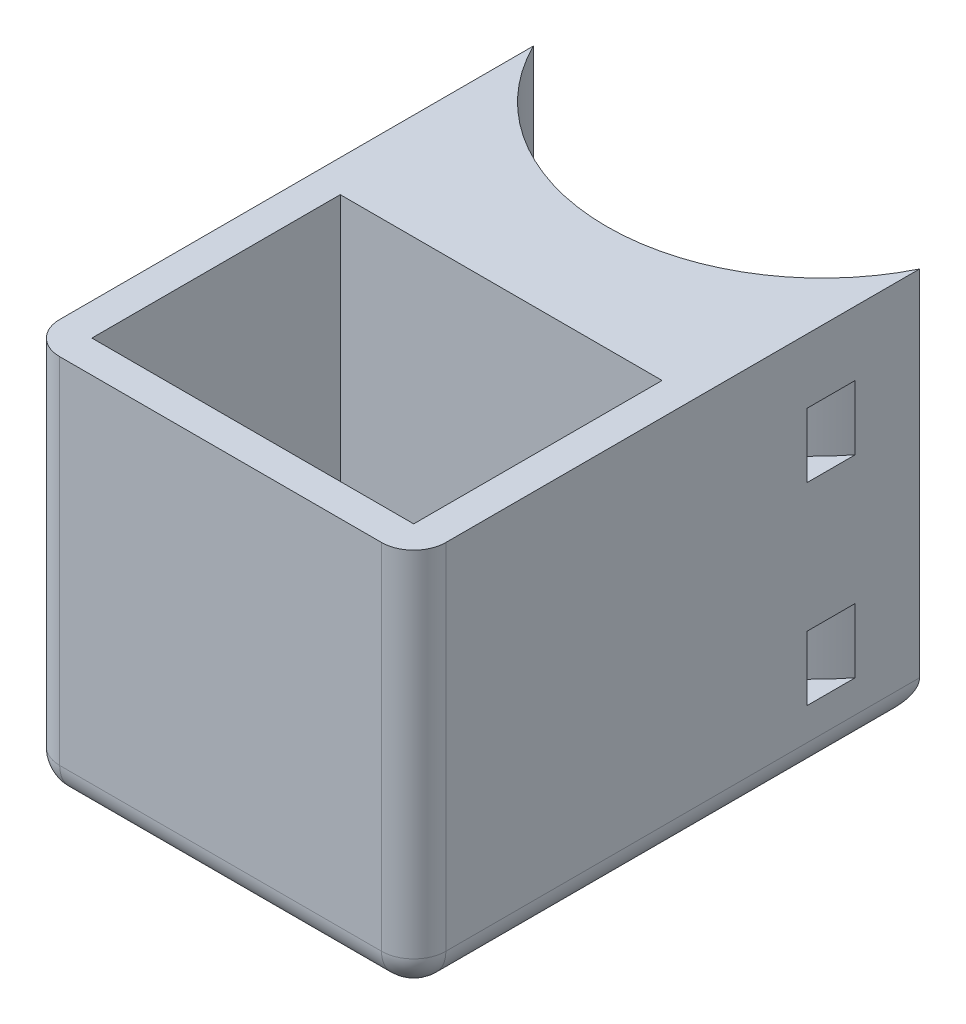
from build123d import *
from OCP.BRepFilletAPI import BRepFilletAPI_MakeChamfer

# Parameters (mm, degrees)
SKETCH2_W           = 152.4
SKETCH2_H           = 152.4
BOSS_EXTRUDE1_DEPTH = 25.4
BOSS_EXTRUDE2_DEPTH = 101.6
BOSS_EXTRUDE5_START = 50.8
BOSS_EXTRUDE5_DEPTH = 50.8
BOSS_EXTRUDE6_DEPTH = 25.4
SKETCH6_W           = 127
SKETCH6_H           = 98.02354915
CUT_EXTRUDE1_DEPTH  = 139.7
SKETCH7_R           = 8.255
CUT_EXTRUDE2_DEPTH  = 12.7
CHAMFER1_SIZE       = 7.62
CHAMFER1_SIZE2      = 2.773453185
FILLET1_R           = 12.7


with BuildPart() as part:
    # Sketch2 → Boss-Extrude1 (new body)
    with BuildSketch(Plane(origin=(0, 0, 0), x_dir=(1, 0, 0), z_dir=(0, 1, 0))):
        with BuildLine():
            Line((0, 76.2), (76.2, 76.2))
            Line((76.2, 76.2), (76.2, 123.42354915))
            ThreePointArc((76.2, 123.42354915), (44.823274072, 88.963087986), (0, 76.2))
        make_face()
        with BuildLine():
            Line((-76.2, 123.42354915), (-76.2, 76.2))
            Line((-76.2, 76.2), (0, 76.2))
            ThreePointArc((0, 76.2), (-44.823274072, 88.963087986), (-76.2, 123.42354915))
        make_face()
        Rectangle(SKETCH2_W, SKETCH2_H)
    extrude(amount=BOSS_EXTRUDE1_DEPTH)

    # Sketch3 → Boss-Extrude2 (add)
    with BuildSketch(Plane(origin=(0, 25.4, 0), x_dir=(1, 0, 0), z_dir=(0, 1, 0))):
        with BuildLine():
            ThreePointArc((76.2, 123.42354915), (0, 76.2), (-76.2, 123.42354915))
            Line((-76.2, 123.42354915), (-76.2, 98.02354915))
            ThreePointArc((-76.2, 98.02354915), (0, 60.787742764), (76.2, 98.02354915))
            Line((76.2, 98.02354915), (76.2, 123.42354915))
        make_face()
        with BuildLine():
            ThreePointArc((76.2, 78.97354915), (0, 46.95399651), (-76.2, 78.97354915))
            Line((-76.2, 78.97354915), (-76.2, -76.2))
            Line((-76.2, -76.2), (76.2, -76.2))
            Line((76.2, -76.2), (76.2, 78.97354915))
        make_face()
    extrude(amount=BOSS_EXTRUDE2_DEPTH)

    # Sketch5 → Boss-Extrude5 (add)
    with BuildSketch(Plane(origin=(0, 0, 0), x_dir=(1, 0, 0), z_dir=(0, 1, 0)).offset(BOSS_EXTRUDE5_START)):
        with BuildLine():
            Line((-76.2, 123.42354915), (-76.2, -76.2))
            Line((-76.2, -76.2), (76.2, -76.2))
            Line((76.2, -76.2), (76.2, 123.42354915))
            ThreePointArc((76.2, 123.42354915), (0, 76.2), (-76.2, 123.42354915))
        make_face()
    extrude(amount=BOSS_EXTRUDE5_DEPTH)

    # Sketch4 → Boss-Extrude6 (add)
    with BuildSketch(Plane(origin=(0, 127, 0), x_dir=(1, 0, 0), z_dir=(0, 1, 0))):
        with BuildLine():
            Line((-76.2, 123.42354915), (-76.2, -76.2))
            Line((-76.2, -76.2), (76.2, -76.2))
            Line((76.2, -76.2), (76.2, 123.42354915))
            ThreePointArc((76.2, 123.42354915), (0, 76.2), (-76.2, 123.42354915))
        make_face()
    extrude(amount=BOSS_EXTRUDE6_DEPTH)

    # Sketch6 → Cut-Extrude1 (cut)
    with BuildSketch(Plane(origin=(0, 152.4, 0), x_dir=(1, 0, 0), z_dir=(0, 1, 0))):
        with Locations((0, -14.488225425)):
            Rectangle(SKETCH6_W, SKETCH6_H)
    extrude(amount=-CUT_EXTRUDE1_DEPTH, mode=Mode.SUBTRACT)

    # Sketch7 → Cut-Extrude2 (cut)
    with BuildSketch(Plane(origin=(0, 12.7, 0), x_dir=(1, 0, 0), z_dir=(0, 1, 0))):
        with Locations(Location((-13.0048, -50.8, 0), (0, 0, 270))):
            Circle(SKETCH7_R)
        with Locations(Location((13.0048, -50.8, 0), (0, 0, 270))):
            Circle(SKETCH7_R)
    extrude(amount=-CUT_EXTRUDE2_DEPTH, mode=Mode.SUBTRACT)

    # Chamfer1: one chamfer whose edges measure the first distance from different faces: ONE call of the kernel's chamfer builder (chamfer() names one face for all edges)
    chamfer1_edges_1 = [part.edges().sort_by_distance(p)[0] for p in [
        (-13.0048, 0, 42.545),
    ]]
    chamfer1_side_1 = [part.faces().sort_by_distance(p)[0] for p in [
        (-13.0048, 6.35, 42.545),
    ]]
    chamfer1_edges_2 = [part.edges().sort_by_distance(p)[0] for p in [
        (13.0048, 0, 42.545),
    ]]
    chamfer1_side_2 = [part.faces().sort_by_distance(p)[0] for p in [
        (13.0048, 6.35, 42.545),
    ]]
    chamfer1 = BRepFilletAPI_MakeChamfer(part.part.solid().wrapped)
    for e in chamfer1_edges_1:
        chamfer1.Add(CHAMFER1_SIZE, CHAMFER1_SIZE2, e.wrapped, chamfer1_side_1[0].wrapped)  # the first distance lies on this face
    for e in chamfer1_edges_2:
        chamfer1.Add(CHAMFER1_SIZE, CHAMFER1_SIZE2, e.wrapped, chamfer1_side_2[0].wrapped)  # the first distance lies on this face
    add(Compound.cast(chamfer1.Shape()), mode=Mode.REPLACE)

    # Fillet1
    fillet1_edges = [part.edges().sort_by_distance(p)[0] for p in [
        (76.2, 76.2, 76.2),
        (-76.2, 76.2, 76.2),
        (76.2, 0, -23.611774575),
        (0, 0, 76.2),
        (-76.2, 0, -23.611774575),
    ]]
    fillet(fillet1_edges, radius=FILLET1_R)


solid = part.part
